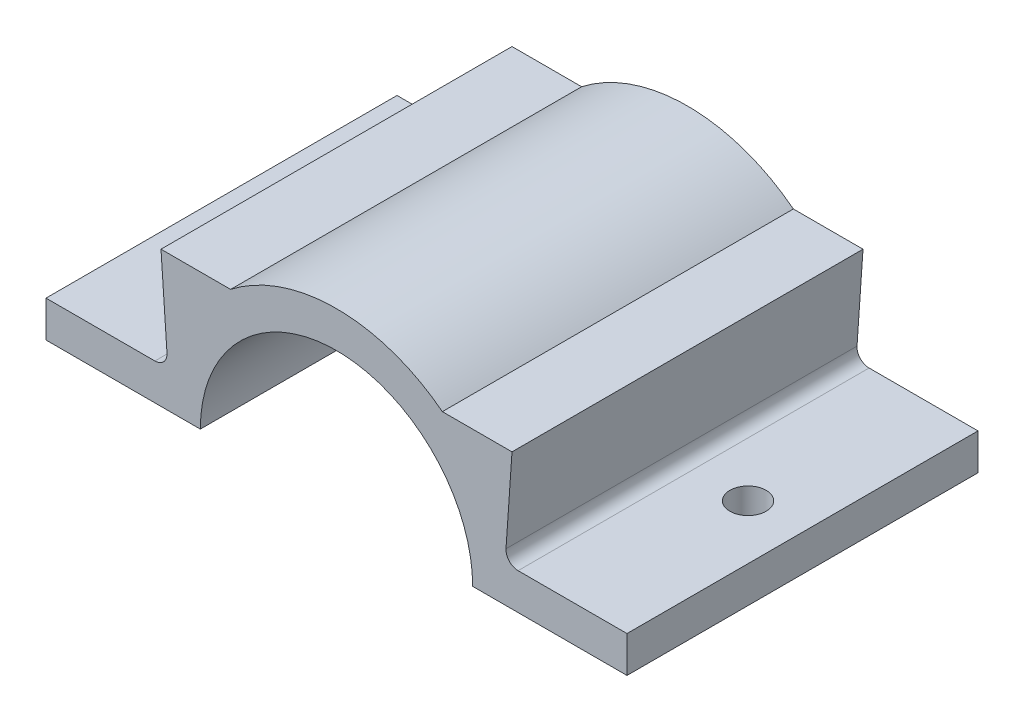
from build123d import *

# Parameters (mm, degrees)
BOSS_EXTRUDE1_DEPTH      = 14.5
BOSS_EXTRUDE1_DEPTH_BACK = 14.5
SKETCH2_R                = 1.5
CUT_EXTRUDE1_DEPTH       = 14.5


with BuildPart() as part:
    # Sketch1 → Boss-Extrude1 (new, two sides: drawn at the far end of the back side and taken through both)
    with BuildSketch(Plane.XY.offset(-BOSS_EXTRUDE1_DEPTH_BACK)):
        with BuildLine():
            Line((-11.25, -7.125), (-20, -7.125))
            Line((-20, -7.125), (-24, -7.125))
            Line((-24, -7.125), (-24, -4.125))
            Line((-24, -4.125), (-20, -4.125))
            Line((-20, -4.125), (-15.002024714, -4.125))
            ThreePointArc((-15.002024714, -4.125), (-14.270980746, -3.807330358), (-14.004397729, -3.056149435))
            Line((-14.004397729, -3.056149435), (-14.5, 4.125))
            Line((-14.5, 4.125), (-8.746427842, 4.125))
            ThreePointArc((-8.746427842, 4.125), (0, 7.125), (8.746427842, 4.125))
            Line((8.746427842, 4.125), (14.5, 4.125))
            Line((14.5, 4.125), (14.004397729, -3.056149435))
            ThreePointArc((14.004397729, -3.056149435), (14.270980746, -3.807330358), (15.002024714, -4.125))
            Line((15.002024714, -4.125), (20, -4.125))
            Line((20, -4.125), (24, -4.125))
            Line((24, -4.125), (24, -7.125))
            Line((24, -7.125), (20, -7.125))
            Line((20, -7.125), (11.25, -7.125))
            ThreePointArc((11.25, -7.125), (0, 4.125), (-11.25, -7.125))
        make_face()
    extrude(amount=BOSS_EXTRUDE1_DEPTH + BOSS_EXTRUDE1_DEPTH_BACK)

    # Sketch2 → Cut-Extrude1 (cut)
    with BuildSketch(Plane(origin=(0, -4.125, 0), x_dir=(1, 0, 0), z_dir=(0, 1, 0))):
        with Locations((-19.501012357, 0)):
            Circle(SKETCH2_R)
        with Locations((19.501012357, 0)):
            Circle(SKETCH2_R)
    extrude(amount=-CUT_EXTRUDE1_DEPTH, mode=Mode.SUBTRACT)


solid = part.part
